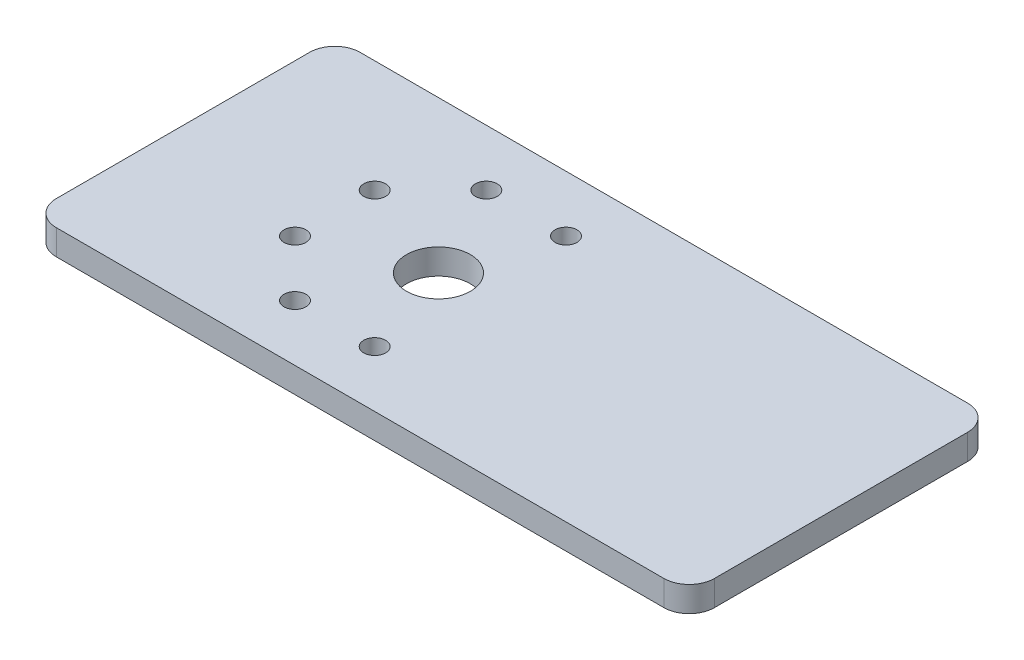
from build123d import *

# Parameters (mm, degrees)
SKETCH1_W                = 165.1
SKETCH1_H                = 76.2
BOSS_EXTRUDE1_DEPTH      = 6.35
M5_CLEARANCE_HOLE1_D     = 5.5
M5_CLEARANCE_HOLE1_DEPTH = 12.7
M5_CLEARANCE_HOLE1_TIP   = 1.652366702
SKETCH5_R                = 8
CUT_EXTRUDE1_DEPTH       = 6.35
FILLET1_R                = 6.35


with BuildPart() as part:
    # Sketch1 → Boss-Extrude1 (new body)
    with BuildSketch(Plane(origin=(0, 0, 0), x_dir=(1, 0, 0), z_dir=(0, 1, 0))):
        Rectangle(SKETCH1_W, SKETCH1_H)
    extrude(amount=BOSS_EXTRUDE1_DEPTH)

    # M5 Clearance Hole1
    with Locations(Plane(origin=(0, 6.35, 0), x_dir=(1, 0, 0), z_dir=(0, 1, 0))):
        with Locations((-44.45, 10), (-44.45, -10), (-18.45, 0), (-10.45, 23.999999994), (-10.45, -24.000000006), (-30.45, 23.999999994), (-30.45, -24.000000006)):
            Hole(M5_CLEARANCE_HOLE1_D / 2, depth=M5_CLEARANCE_HOLE1_DEPTH)
            with Locations((0, 0, -(M5_CLEARANCE_HOLE1_DEPTH + M5_CLEARANCE_HOLE1_TIP / 2))):  # 118° drill point
                Cone(0, M5_CLEARANCE_HOLE1_D / 2, M5_CLEARANCE_HOLE1_TIP, mode=Mode.SUBTRACT)

    # Sketch5 → Cut-Extrude1 (cut)
    with BuildSketch(Plane(origin=(0, 6.35, 0), x_dir=(1, 0, 0), z_dir=(0, 1, 0))):
        with Locations(Location((-18.45, 0, 0), (0, 0, 270))):
            Circle(SKETCH5_R)
    extrude(amount=-CUT_EXTRUDE1_DEPTH, mode=Mode.SUBTRACT)

    # Fillet1
    fillet1_edges = [part.edges().sort_by_distance(p)[0] for p in [
        (82.55, 3.175, 38.1),
        (-82.55, 3.175, 38.1),
        (-82.55, 3.175, -38.1),
        (82.55, 3.175, -38.1),
    ]]
    fillet(fillet1_edges, radius=FILLET1_R)


solid = part.part
